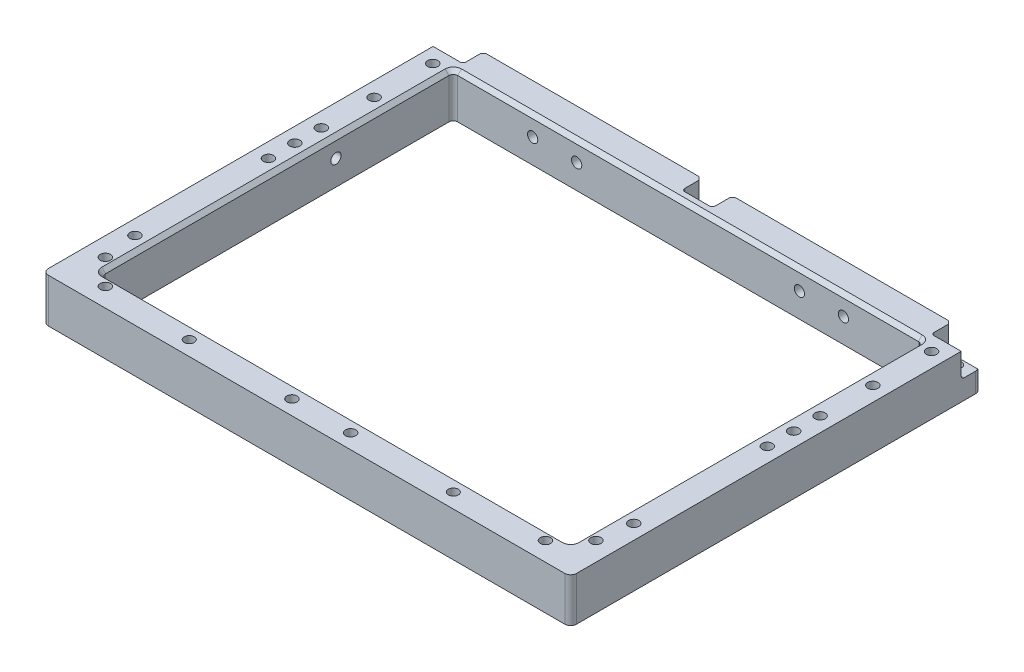
from build123d import *

# Parameters (mm, degrees)
SKETCH1_W                    = 228.6
SKETCH1_H                    = 177.8
SKETCH1_W_2                  = 203.2
SKETCH1_H_2                  = 152.4
BOSS_EXTRUDE1_DEPTH          = 19.05
SKETCH2_W                    = 12.954
SKETCH2_H                    = 10.541
SKETCH2_W_2                  = 13.208
CUT_EXTRUDE1_DEPTH           = 8.763
SKETCH3_R                    = 2.2225
FRONT_BASE_MOUNTHOLES_DEPTH  = 7.112
FILLET2_R                    = 1.27
CHAMFER1_SIZE                = 1.27
SKETCH4_R                    = 2.2225
FRONT_BASE_MOUNTHOLES2_DEPTH = 7.62
SKETCH5_R                    = 2.2225
REAR_WALL_MOUNTHOLES_DEPTH   = 7.62
FILLET3_R                    = 1.905
SKETCH6_R                    = 2.2225
MOTOR_MOUNT_HOLES_DEPTH      = 7.366
CHAMFER2_SIZE                = 1.651
SKETCH7_R                    = 2.2225
REARBRACE_MOUNTHOLES_DEPTH   = 7.62
SKETCH8_R                    = 2.2225
SIDEBRACE_MOUNTHOLES_DEPTH   = 7.112
SKETCH9_R                    = 2.159
BATTERYMOUNT_HOLES_DEPTH     = 8.89
FILLET4_R                    = 2.54
SKETCH10_R                   = 2.2225
MOTOR_BRACE_MOUNTHOLES_DEPTH = 5.588
SKETCH11_R                   = 2.2225
DRIVETRAIN_BRACE2HOLE_DEPTH  = 7.239


with BuildPart() as part:
    # Sketch1 → Boss-Extrude1 (new body)
    with BuildSketch(Plane(origin=(0, 0, 0), x_dir=(1, 0, 0), z_dir=(0, 1, 0))):
        Rectangle(SKETCH1_W, SKETCH1_H)
        Rectangle(SKETCH1_W_2, SKETCH1_H_2, mode=Mode.SUBTRACT)
    extrude(amount=BOSS_EXTRUDE1_DEPTH)

    # Sketch2 → Cut-Extrude1 (cut)
    with BuildSketch(Plane(origin=(0, 0, -88.9), x_dir=(-1, 0, 0), z_dir=(0, 0, -1))):
        with Locations((107.823, 13.7795)):
            Rectangle(SKETCH2_W, SKETCH2_H)
        with Locations((0, 13.7795)):
            Rectangle(SKETCH2_W_2, SKETCH2_H)
        with Locations((-107.823, 13.7795)):
            Rectangle(SKETCH2_W, SKETCH2_H)
    extrude(amount=-CUT_EXTRUDE1_DEPTH, mode=Mode.SUBTRACT)

    # Sketch3 → Front-Base-MountHoles (cut)
    with BuildSketch(Plane(origin=(0, 8.509, 0), x_dir=(1, 0, 0), z_dir=(0, 1, 0))):
        with Locations(Location((-107.823, 84.5185, 0), (0, 0, 270))):
            Circle(SKETCH3_R)
        with Locations(Location((0, 84.5185, 0), (0, 0, 270))):
            Circle(SKETCH3_R)
        with Locations(Location((107.823, 84.5185, 0), (0, 0, 90))):
            Circle(SKETCH3_R)
    extrude(amount=-FRONT_BASE_MOUNTHOLES_DEPTH, mode=Mode.SUBTRACT)

    # Fillet2
    fillet2_edges = [part.edges().sort_by_distance(p)[0] for p in [
        (-107.823, 8.509, -80.137),
        (-101.346, 13.7795, -80.137),
        (-101.346, 8.509, -84.5185),
        (0, 8.509, -80.137),
        (-6.604, 8.509, -84.5185),
        (6.604, 13.7795, -80.137),
        (6.604, 8.509, -84.5185),
        (-6.604, 13.7795, -80.137),
        (101.346, 13.7795, -80.137),
        (107.823, 8.509, -80.137),
        (101.346, 8.509, -84.5185),
    ]]
    fillet(fillet2_edges, radius=FILLET2_R)

    # Chamfer1
    chamfer1_edges = [part.edges().sort_by_distance(p)[0] for p in [
        (-108.458, 8.509, -88.9),
        (101.717974388, 8.880974388, -88.9),
        (-6.232025612, 8.880974388, -88.9),
        (6.232025612, 8.880974388, -88.9),
        (-101.717974388, 8.880974388, -88.9),
        (-101.346, 14.4145, -88.9),
        (6.604, 14.4145, -88.9),
        (108.458, 8.509, -88.9),
        (101.346, 14.4145, -88.9),
        (-6.604, 14.4145, -88.9),
        (0, 8.509, -88.9),
    ]]
    chamfer(chamfer1_edges, length=CHAMFER1_SIZE)

    # Sketch4 → Front-base-MountHoles2 (cut)
    with BuildSketch(Plane(origin=(0, 0, -88.9), x_dir=(-1, 0, 0), z_dir=(0, 0, -1))):
        with Locations((-20.32, 9.525)):
            Circle(SKETCH4_R)
        with Locations((-81.28, 9.525)):
            Circle(SKETCH4_R)
        with Locations((81.28, 9.525)):
            Circle(SKETCH4_R)
        with Locations((20.32, 9.525)):
            Circle(SKETCH4_R)
    extrude(amount=-FRONT_BASE_MOUNTHOLES2_DEPTH, mode=Mode.SUBTRACT)

    # Sketch5 → Rear-Wall-MountHoles (cut)
    with BuildSketch(Plane(origin=(0, 19.05, 0), x_dir=(1, 0, 0), z_dir=(0, 1, 0))):
        with Locations(Location((-95.25, -80.772, 0), (0, 0, 270))):
            Circle(SKETCH5_R)
        with Locations(Location((-106.172, -69.85, 0), (0, 0, 270))):
            Circle(SKETCH5_R)
        with Locations(Location((106.172, -69.85, 0), (0, 0, 270))):
            Circle(SKETCH5_R)
        with Locations(Location((95.25, -80.772, 0), (0, 0, 270))):
            Circle(SKETCH5_R)
    extrude(amount=-REAR_WALL_MOUNTHOLES_DEPTH, mode=Mode.SUBTRACT)

    # Fillet3
    fillet3_edges = [part.edges().sort_by_distance(p)[0] for p in [
        (101.6, 9.525, 76.2),
        (101.6, 9.525, -76.2),
        (-101.6, 9.525, -76.2),
        (-101.6, 9.525, 76.2),
    ]]
    fillet(fillet3_edges, radius=FILLET3_R)

    # Sketch6 → Motor_Mount_Holes (cut)
    with BuildSketch(Plane(origin=(0, 19.05, 0), x_dir=(1, 0, 0), z_dir=(0, 1, 0))):
        with Locations(Location((107.95, -55.245, 0), (0, 0, 270))):
            Circle(SKETCH6_R)
        with Locations(Location((107.95, 2.54, 0), (0, 0, 270))):
            Circle(SKETCH6_R)
        with Locations(Location((107.95, 13.97, 0), (0, 0, 270))):
            Circle(SKETCH6_R)
        with Locations(Location((107.95, 25.4, 0), (0, 0, 270))):
            Circle(SKETCH6_R)
        with Locations(Location((-107.95, 25.4, 0), (0, 0, 90))):
            Circle(SKETCH6_R)
        with Locations(Location((-107.95, 13.97, 0), (0, 0, 90))):
            Circle(SKETCH6_R)
        with Locations(Location((-107.95, 2.54, 0), (0, 0, 90))):
            Circle(SKETCH6_R)
        with Locations(Location((-107.95, -55.245, 0), (0, 0, 90))):
            Circle(SKETCH6_R)
    extrude(amount=-MOTOR_MOUNT_HOLES_DEPTH, mode=Mode.SUBTRACT)

    # Chamfer2
    chamfer2_edges = [part.edges().sort_by_distance(p)[0] for p in [
        (-101.6, 19.05, 0),
        (0, 19.05, 76.2),
        (101.6, 19.05, 0),
        (0, 19.05, -76.2),
        (-101.042038418, 19.05, 75.642038418),
        (101.042038418, 19.05, 75.642038418),
        (101.042038418, 19.05, -75.642038418),
        (-101.042038418, 19.05, -75.642038418),
    ]]
    chamfer(chamfer2_edges, length=CHAMFER2_SIZE)

    # Sketch7 → RearBrace_MountHoles (cut)
    with BuildSketch(Plane(origin=(0, 19.05, 0), x_dir=(1, 0, 0), z_dir=(0, 1, 0))):
        with Locations(Location((-12.7, -82.55, 0), (0, 0, 270))):
            Circle(SKETCH7_R)
        with Locations(Location((12.7, -82.55, 0), (0, 0, 270))):
            Circle(SKETCH7_R)
    extrude(amount=-REARBRACE_MOUNTHOLES_DEPTH, mode=Mode.SUBTRACT)

    # Sketch8 → SideBrace_MountHoles (cut)
    with BuildSketch(Plane(origin=(0, 19.05, 0), x_dir=(1, 0, 0), z_dir=(0, 1, 0))):
        with Locations(Location((107.95, 73.66, 0), (0, 0, 270))):
            Circle(SKETCH8_R)
        with Locations(Location((107.95, 48.26, 0), (0, 0, 90))):
            Circle(SKETCH8_R)
        with Locations(Location((-107.95, 48.26, 0), (0, 0, 270))):
            Circle(SKETCH8_R)
        with Locations(Location((-107.95, 73.66, 0), (0, 0, 90))):
            Circle(SKETCH8_R)
    extrude(amount=-SIDEBRACE_MOUNTHOLES_DEPTH, mode=Mode.SUBTRACT)

    # Sketch9 → BatteryMount_Holes (cut)
    with BuildSketch(Plane(origin=(0, 19.05, 0), x_dir=(1, 0, 0), z_dir=(0, 1, 0))):
        with Locations(Location((-57.15, -82.55, 0), (0, 0, 270))):
            Circle(SKETCH9_R)
        with Locations(Location((57.15, -82.55, 0), (0, 0, 90))):
            Circle(SKETCH9_R)
    extrude(amount=-BATTERYMOUNT_HOLES_DEPTH, mode=Mode.SUBTRACT)

    # Fillet4
    fillet4_edges = [part.edges().sort_by_distance(p)[0] for p in [
        (-114.3, 3.6195, -88.9),
        (114.3, 3.6195, -88.9),
        (-114.3, 9.525, 88.9),
        (114.3, 9.525, 88.9),
    ]]
    fillet(fillet4_edges, radius=FILLET4_R)

    # Sketch10 → Motor-Brace-MountHoles (cut)
    with BuildSketch(Plane.XY.offset(-76.2)):
        with Locations((48.20666, 10.541)):
            Circle(SKETCH10_R)
        with Locations((67.25666, 10.541)):
            Circle(SKETCH10_R)
        with Locations(Location((-67.25666, 10.541, 0), (0, 0, 180))):
            Circle(SKETCH10_R)
        with Locations(Location((-48.20666, 10.541, 0), (0, 0, 180))):
            Circle(SKETCH10_R)
    extrude(amount=-MOTOR_BRACE_MOUNTHOLES_DEPTH, mode=Mode.SUBTRACT)

    # Sketch11 → DriveTrain-Brace2Hole (cut)
    with BuildSketch(Plane.ZY.offset(-101.6)):
        with Locations((-25.4, 10.795)):
            Circle(SKETCH11_R)
    drivetrain_brace2hole = extrude(amount=-DRIVETRAIN_BRACE2HOLE_DEPTH, mode=Mode.SUBTRACT)

    # Mirror1: DriveTrain-Brace2Hole across plane
    add(drivetrain_brace2hole.mirror(Plane(origin=(0, 0, 0), x_dir=(0, 0, 1), z_dir=(1, 0, 0))), mode=Mode.SUBTRACT)


solid = part.part
